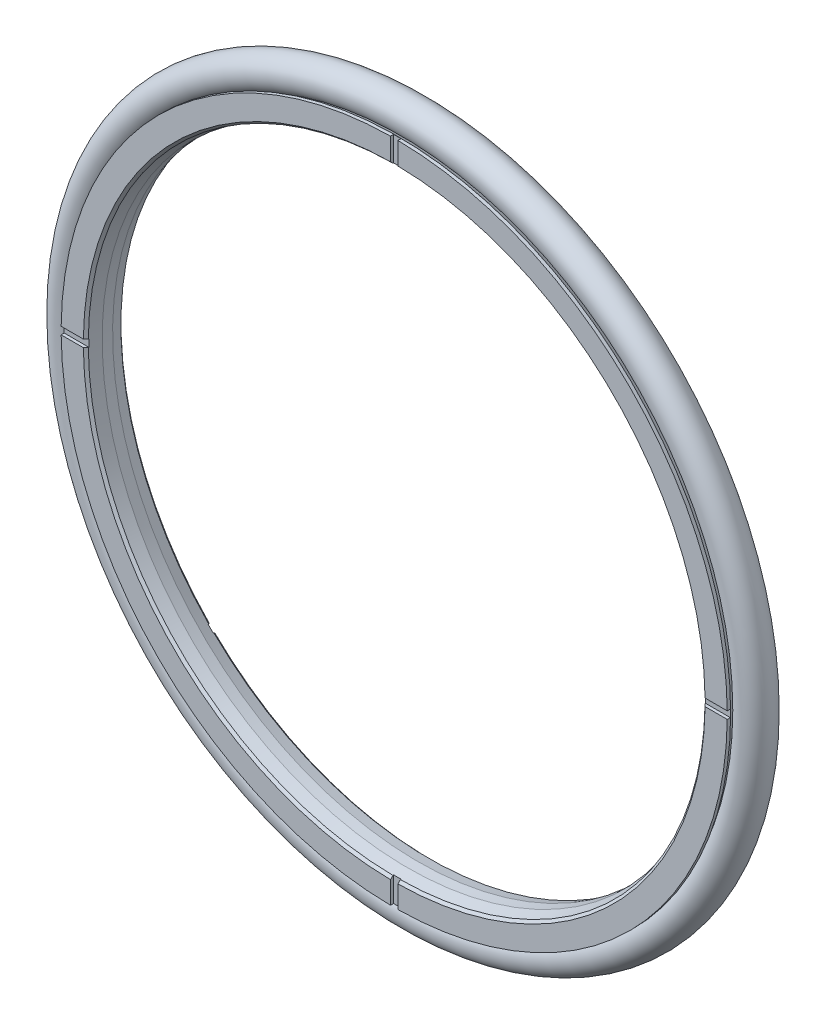
from build123d import *

# Parameters (mm, degrees)
SKETCH3_W          = 1.2
SKETCH3_H          = 54.567734246
CUT_EXTRUDE1_DEPTH = 0.5
CUT_EXTRUDE2_DEPTH = 0.5
CIRPATTERN1_COUNT  = 4
SKETCH2_R          = 2.665


with BuildPart() as part:
    # Sketch1 → Revolve1 (revolve)
    with BuildSketch(Plane(origin=(0, 0, 0), x_dir=(0, 0, -1), z_dir=(1, 0, 0)), mode=Mode.PRIVATE) as revolve1_sk:
        with BuildLine():
            Line((-3.05, 54.05), (-3.05, 50.45))
            Line((-3.05, 50.45), (-2.65, 50.05))
            Line((-2.65, 50.05), (-0.85, 49.6))
            Line((-0.85, 49.6), (0.85, 49.6))
            Line((0.85, 49.6), (2.65, 50.05))
            Line((2.65, 50.05), (3.05, 50.45))
            Line((3.05, 50.45), (3.05, 54.05))
            Line((3.05, 54.05), (2.49949995, 54.05))
            ThreePointArc((2.49949995, 54.05), (0, 53), (-2.49949995, 54.05))
            Line((-2.49949995, 54.05), (-3.05, 54.05))
        make_face()
    revolve(revolve1_sk.sketch.rotate(Axis((0, 0, 0), (0, 0, -1)), 90), axis=Axis((0, 0, 0), (0, 0, -1)))

    # Sketch3 → Cut-Extrude1 (cut)
    with BuildSketch(Plane.XY.offset(3.05)):
        with Locations((0, 27.283867123)):
            Rectangle(SKETCH3_W, SKETCH3_H)
    cut_extrude1 = extrude(amount=-CUT_EXTRUDE1_DEPTH, mode=Mode.SUBTRACT)

    # Sketch4 → Cut-Extrude2 (cut)
    with BuildSketch(Plane(origin=(0, 0, -3.05), x_dir=(-1, 0, 0), z_dir=(0, 0, -1))):
        Polygon((0.424264069, -0.424264069), (-0.424264069, 0.424264069), (46.107028369, 46.955556506), (46.955556506, 46.107028369), align=None)
    cut_extrude2 = extrude(amount=-CUT_EXTRUDE2_DEPTH, mode=Mode.SUBTRACT)

    # CirPattern1: Cut-Extrude1, Cut-Extrude2 ×4 about axis
    cirpattern1_axis = Axis((0, 0, 0), (0, 0, 1))
    add([cut_extrude1.rotate(cirpattern1_axis, i * 360 / CIRPATTERN1_COUNT) for i in range(1, CIRPATTERN1_COUNT)], mode=Mode.SUBTRACT)
    add([cut_extrude2.rotate(cirpattern1_axis, i * 360 / CIRPATTERN1_COUNT) for i in range(1, CIRPATTERN1_COUNT)], mode=Mode.SUBTRACT)


with BuildPart() as body_2:
    # Sketch2 → Revolve2 (revolve)
    with BuildSketch(Plane(origin=(0, 0, 0), x_dir=(0, 0, -1), z_dir=(1, 0, 0)), mode=Mode.PRIVATE) as revolve2_sk:
        with Locations((0, 55.665)):
            Circle(SKETCH2_R)
    revolve(revolve2_sk.sketch.rotate(Axis((0, 0, 0), (0, 0, -1)), 314.312777771), axis=Axis((0, 0, 0), (0, 0, -1)))


solid = Compound([part.part, body_2.part])
